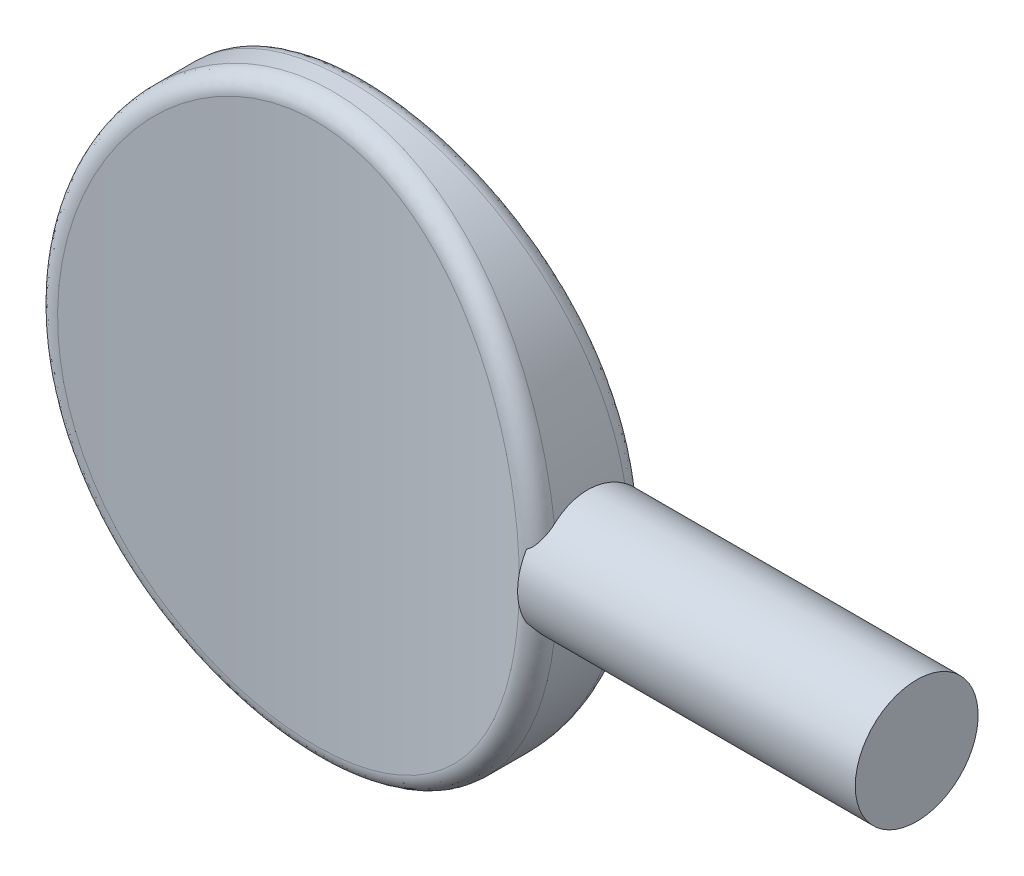
from build123d import *

# Parameters (mm, degrees)
SKETCH1_RX              = 11.303
SKETCH1_RY              = 9.906
EXTRUDE1_DEPTH          = 2.286
CUT_EXTRUDE1_DEPTH      = 16.202382741
CUT_EXTRUDE1_DEPTH_BACK = 16.202382741
SKETCH2_OUTSIDE_W       = 27.892
SKETCH2_OUTSIDE_H       = 12.652
FILLET3_R               = 0.677333333


with BuildPart() as part:
    # Sketch1 → Extrude1 (new, symmetric)
    with BuildSketch(Plane.XY):
        with Locations(Location((0, 0), (0, 0, -90))):
            Ellipse(SKETCH1_RX, SKETCH1_RY)
    extrude(amount=EXTRUDE1_DEPTH, both=True)

    # Sketch2 outside → Cut-Extrude1 (cut, two sides: drawn at the far end of the back side and taken through both)
    with BuildSketch(Plane(origin=(0, 0, 0), x_dir=(1, 0, 0), z_dir=(0, 1, 0)).offset(-CUT_EXTRUDE1_DEPTH_BACK)):
        Rectangle(SKETCH2_OUTSIDE_W, SKETCH2_OUTSIDE_H)
        with BuildLine():
            Line((-9.906, 2.286), (-9.906, -2.286))
            ThreePointArc((-9.906, -2.286), (0, -1.016), (9.906, -2.286))
            Line((9.906, -2.286), (9.906, 2.286))
            ThreePointArc((9.906, 2.286), (0, 1.016), (-9.906, 2.286))
        make_face(mode=Mode.SUBTRACT)
    extrude(amount=CUT_EXTRUDE1_DEPTH + CUT_EXTRUDE1_DEPTH_BACK, mode=Mode.SUBTRACT)

    # Fillet3
    fillet3_edges = [part.edges().sort_by_distance(p)[0] for p in [
        (-7.228513924, -7.728494619, 1.687044844),
        (3.75e-07, 11.303, -1.016),
    ]]
    fillet(fillet3_edges, radius=FILLET3_R)

    # Sketch3 → Revolve1 (revolve)
    with BuildSketch(Plane(origin=(0, 0, 0), x_dir=(1, 0, 0), z_dir=(0, 1, 0))):
        with BuildLine():
            Line((13.208, 2.413), (22.606, 2.413))
            Line((22.606, 2.413), (22.606, 0))
            Line((22.606, 0), (9.072182281, 0))
            Line((9.072182281, 0), (9.072182281, 2.078343579))
            ThreePointArc((9.072182281, 2.078343579), (9.262571156, 2.199720149), (9.336678517, 2.413))
            Line((9.336678517, 2.413), (13.208, 2.413))
        make_face()
    revolve(axis=Axis((0, 0, 0), (1, 0, 0)))


solid = part.part
